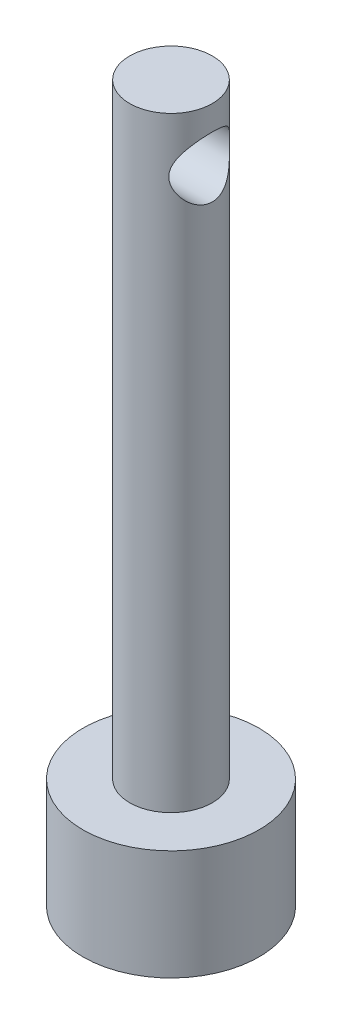
from build123d import *

# Parameters (mm, degrees)
SKETCH3_R               = 1.6
BOSS_EXTRUDE1_DEPTH     = 2
SKETCH4_R               = 0.75
BOSS_EXTRUDE2_DEPTH     = 11
CUT_EXTRUDE1_DEPTH      = 14.195453763
CUT_EXTRUDE1_DEPTH_BACK = 14.195453763
SKETCH5_R               = 0.55


with BuildPart() as part:
    # Sketch3 → Boss-Extrude1 (new body)
    with BuildSketch(Plane(origin=(0, 0, 0), x_dir=(1, 0, 0), z_dir=(0, 1, 0))):
        with Locations(Location((0, 0, 0), (0, 0, 270))):
            Circle(SKETCH3_R)
    extrude(amount=BOSS_EXTRUDE1_DEPTH)

    # Sketch4 → Boss-Extrude2 (add)
    with BuildSketch(Plane(origin=(0, 2, 0), x_dir=(1, 0, 0), z_dir=(0, 1, 0))):
        with Locations(Location((0, 0, 0), (0, 0, 270))):
            Circle(SKETCH4_R)
    extrude(amount=BOSS_EXTRUDE2_DEPTH)

    # Sketch5 → Cut-Extrude1 (cut, two sides: drawn at the far end of the back side and taken through both)
    with BuildSketch(Plane(origin=(0, 0, 0), x_dir=(0, 0, -1), z_dir=(1, 0, 0)).offset(-CUT_EXTRUDE1_DEPTH_BACK)):
        with Locations((0, 12.002505873)):
            Circle(SKETCH5_R)
    extrude(amount=CUT_EXTRUDE1_DEPTH + CUT_EXTRUDE1_DEPTH_BACK, mode=Mode.SUBTRACT)


solid = part.part
